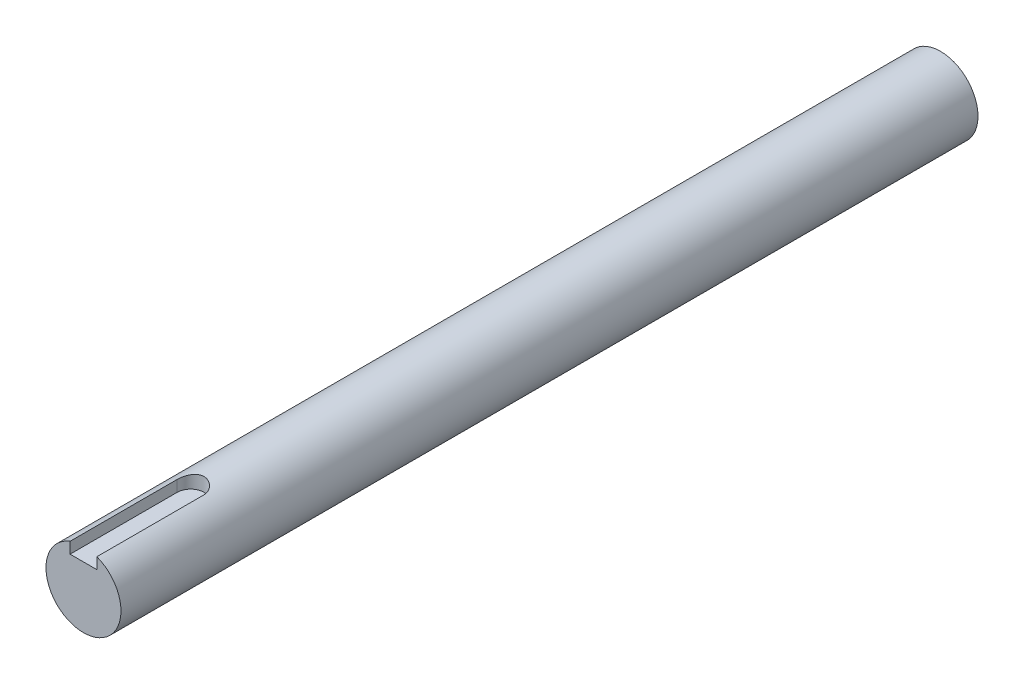
from build123d import *

# Parameters (mm, degrees)
ESQUISSE1_R                  = 7
BOSS_EXTRU_1_DEPTH           = 160
ESQUISSE2_R                  = 4.188125
ENL_V_MAT_EXTRU_1_DEPTH      = 20
ENL_V_MAT_EXTRU_2_DEPTH      = 2.5
ENL_V_MAT_EXTRU_2_DEPTH_BACK = 2.5


with BuildPart() as part:
    # Esquisse1 → Boss.-Extru.1 (new body)
    with BuildSketch(Plane.XY):
        Circle(ESQUISSE1_R)
    extrude(amount=BOSS_EXTRU_1_DEPTH)

    # Esquisse2 → Enlèv. mat.-Extru.1 (cut)
    with BuildSketch(Plane(origin=(0, 0, 0), x_dir=(-1, 0, 0), z_dir=(0, 0, -1))):
        Circle(ESQUISSE2_R)
    extrude(amount=-ENL_V_MAT_EXTRU_1_DEPTH, mode=Mode.SUBTRACT)

    # Esquisse3 → Enlèv. mat.-Extru.2 (cut, two sides: drawn at the far end of the back side and taken through both)
    with BuildSketch(Plane.XZ.offset(-6.946049008).offset(-ENL_V_MAT_EXTRU_2_DEPTH_BACK)):
        with BuildLine():
            Line((2.5, 160), (2.5, 140))
            ThreePointArc((2.5, 140), (0, 137.5), (-2.5, 140))
            Line((-2.5, 140), (-2.5, 160))
            ThreePointArc((-2.5, 160), (0, 162.5), (2.5, 160))
        make_face()
    extrude(amount=ENL_V_MAT_EXTRU_2_DEPTH + ENL_V_MAT_EXTRU_2_DEPTH_BACK, mode=Mode.SUBTRACT)


solid = part.part
